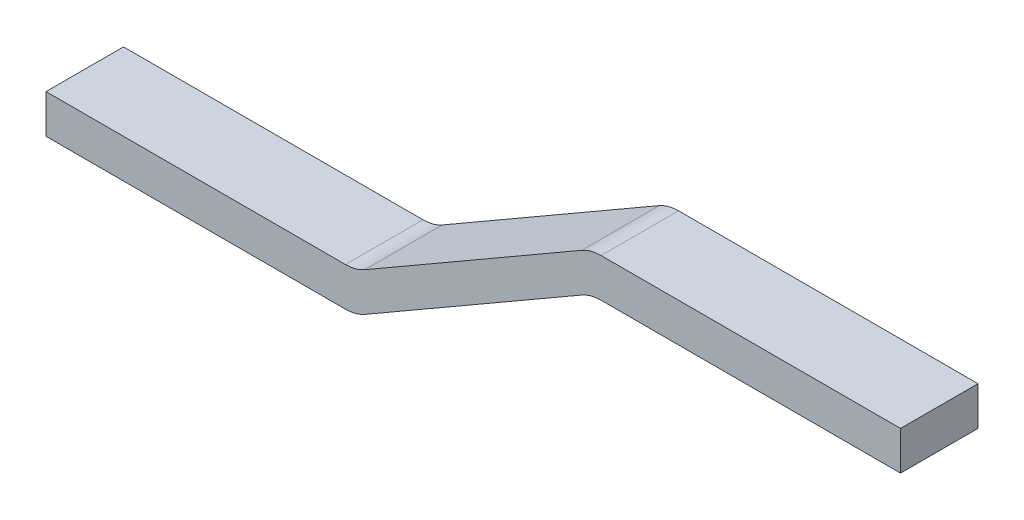
from build123d import *

# Parameters (mm, degrees)
BOSS_EXTRU_1_DEPTH = 10
CONG_1_R           = 5


with BuildPart() as part:
    # Esquisse1 → Boss.-Extru.1 (new body)
    with BuildSketch(Plane.XY):
        Polygon((-20, 5), (20, 5), (50.310889132, 22.5), (90.310889132, 22.5), (90.310889132, 17.5), (50.310889132, 17.5), (20, 0), (-20, 0), align=None)
    extrude(amount=BOSS_EXTRU_1_DEPTH)

    # Congé1
    cong_1_edges = [part.edges().sort_by_distance(p)[0] for p in [
        (20, 0, 5),
        (50.310889132, 17.5, 5),
        (50.310889132, 22.5, 5),
        (20, 5, 5),
    ]]
    fillet(cong_1_edges, radius=CONG_1_R)


solid = part.part
